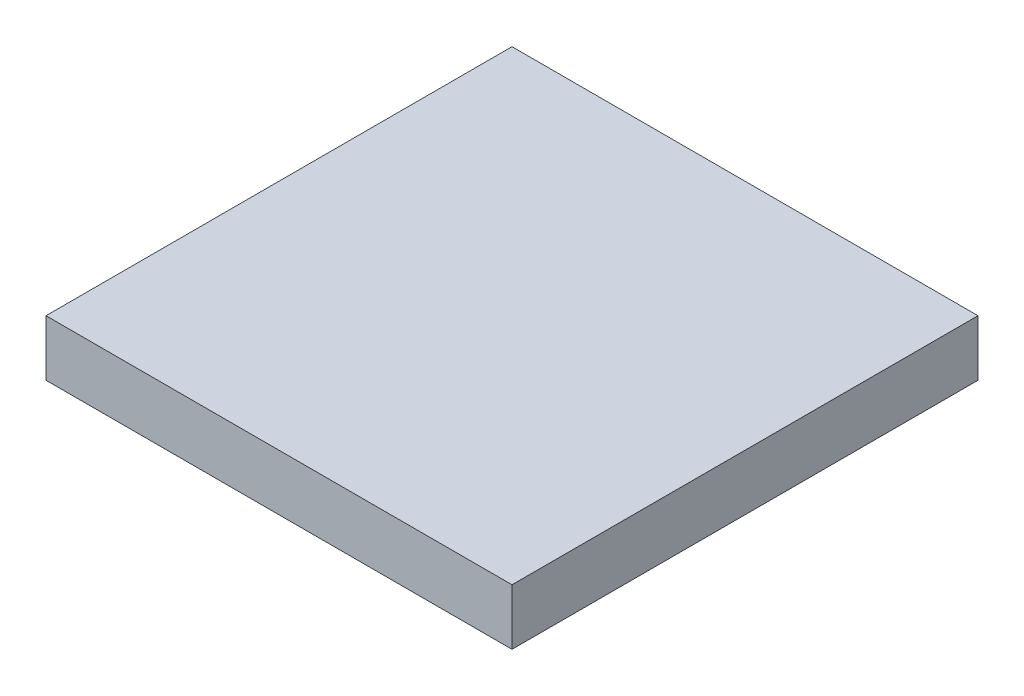
from build123d import *

# Parameters (mm, degrees)
SKETCH1_W           = 50
SKETCH1_H           = 50
BOSS_EXTRUDE2_DEPTH = 6


with BuildPart() as part:
    # Sketch1 → Boss-Extrude2 (new body)
    with BuildSketch(Plane(origin=(0, 0, 0), x_dir=(1, 0, 0), z_dir=(0, 1, 0))):
        with Locations((25, 25)):
            Rectangle(SKETCH1_W, SKETCH1_H)
    extrude(amount=BOSS_EXTRUDE2_DEPTH)


solid = part.part
